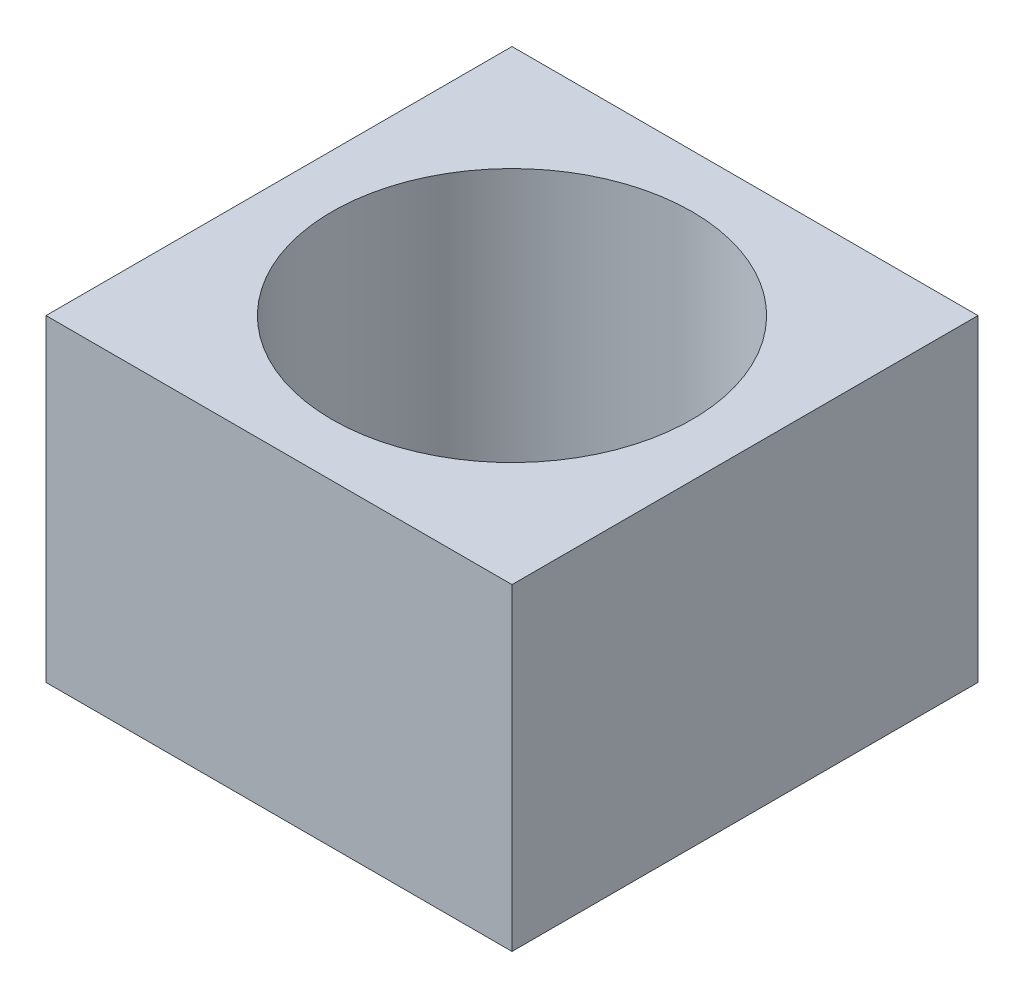
from build123d import *

# Parameters (mm, degrees)
SKETCH_1_W          = 44
SKETCH_1_H          = 44
EXTRUDE_1_DEPTH     = 30
SKETCH_2_R          = 17
CUT_EXTRUDE_1_DEPTH = 30


with BuildPart() as part:
    # 草图1 → 凸台-拉伸1 (new body)
    with BuildSketch(Plane(origin=(0, 0, 0), x_dir=(1, 0, 0), z_dir=(0, 1, 0))):
        Rectangle(SKETCH_1_W, SKETCH_1_H)
    extrude(amount=EXTRUDE_1_DEPTH)

    # 草图2 → 切除-拉伸1 (cut)
    with BuildSketch(Plane(origin=(0, 0, 0), x_dir=(1, 0, 0), z_dir=(0, 1, 0))):
        with Locations(Location((0, 0, 0), (0, 0, 270))):
            Circle(SKETCH_2_R)
    extrude(amount=CUT_EXTRUDE_1_DEPTH, mode=Mode.SUBTRACT)


solid = part.part
